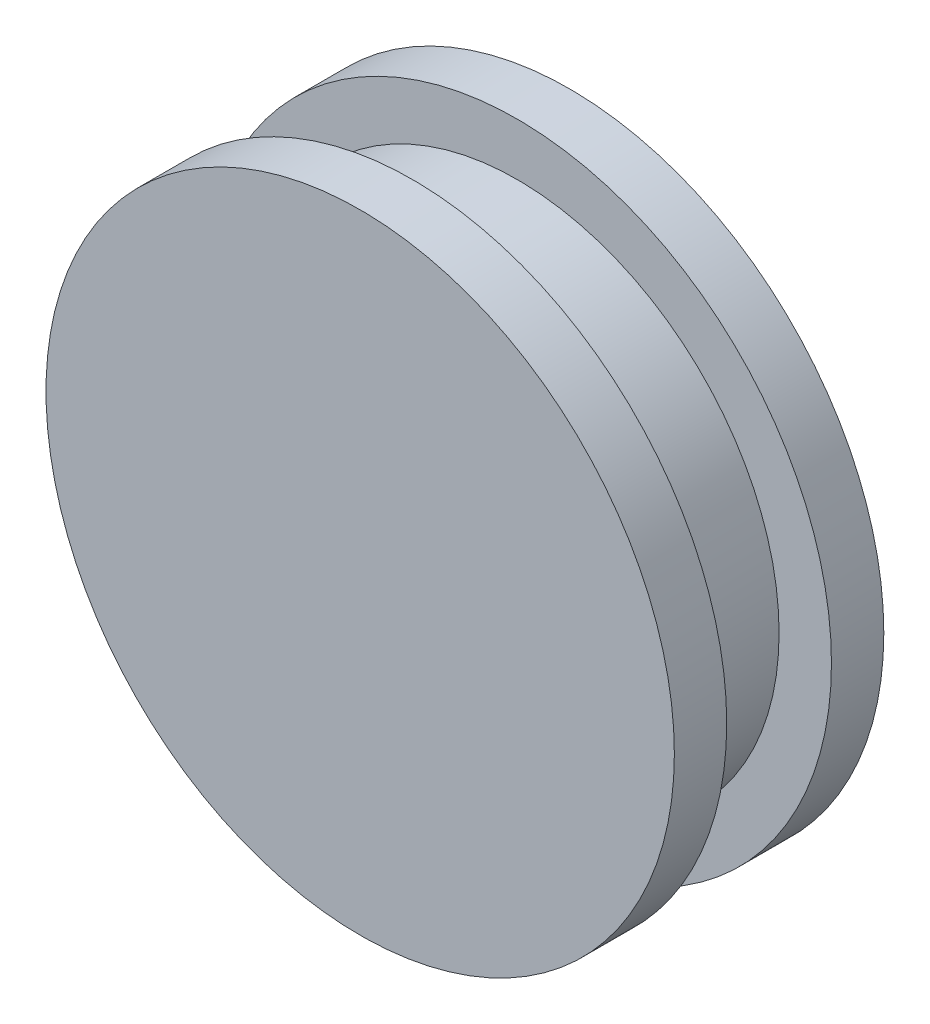
from build123d import *

# Parameters (mm, degrees)
SKETCH1_R           = 300
BOSS_EXTRUDE1_DEPTH = 50
SKETCH2_R           = 20
CUT_EXTRUDE1_DEPTH  = 20
SKETCH4_R           = 250
BOSS_EXTRUDE2_DEPTH = 100
SKETCH6_R           = 300
BOSS_EXTRUDE3_DEPTH = 50


with BuildPart() as part:
    # Sketch1 → Boss-Extrude1 (new body)
    with BuildSketch(Plane.XY):
        Circle(SKETCH1_R)
    extrude(amount=BOSS_EXTRUDE1_DEPTH)

    # Sketch2 → Cut-Extrude1 (cut)
    with BuildSketch(Plane(origin=(0, 0, 0), x_dir=(-1, 0, 0), z_dir=(0, 0, -1))):
        Circle(SKETCH2_R)
    extrude(amount=-CUT_EXTRUDE1_DEPTH, mode=Mode.SUBTRACT)

    # Sketch4 → Boss-Extrude2 (add)
    with BuildSketch(Plane.XY.offset(50)):
        Circle(SKETCH4_R)
    extrude(amount=BOSS_EXTRUDE2_DEPTH)

    # Sketch6 → Boss-Extrude3 (add)
    with BuildSketch(Plane.XY.offset(150)):
        Circle(SKETCH6_R)
    extrude(amount=BOSS_EXTRUDE3_DEPTH)


solid = part.part
